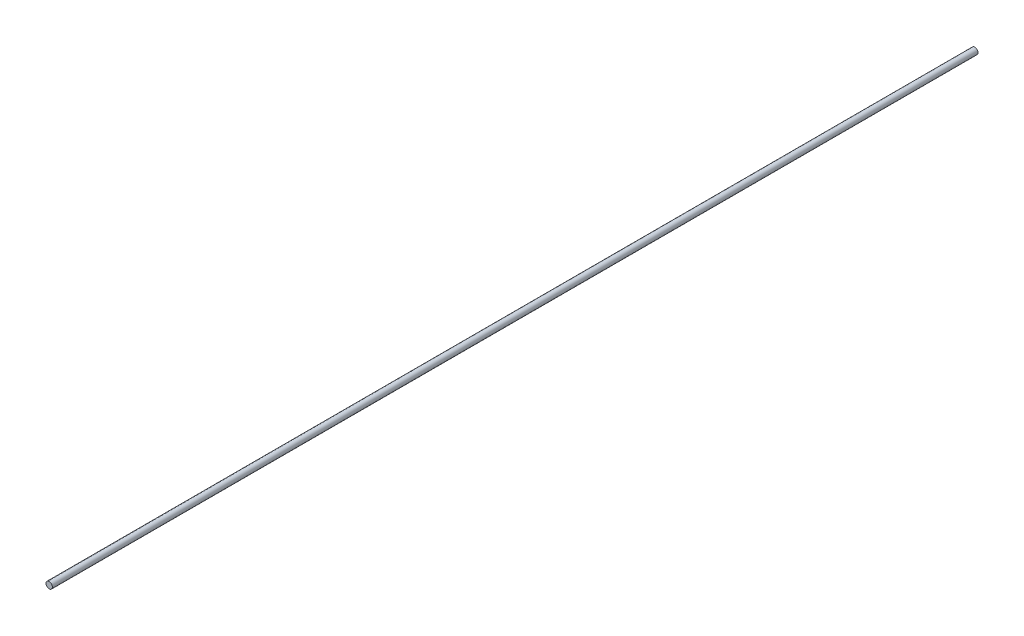
from build123d import *

# Parameters (mm, degrees)
SKETCH_1_R      = 1
EXTRUDE_1_DEPTH = 290


with BuildPart() as part:
    # 草图1 → 凸台-拉伸1 (new body)
    with BuildSketch(Plane.XY):
        Circle(SKETCH_1_R)
    extrude(amount=EXTRUDE_1_DEPTH)


solid = part.part
